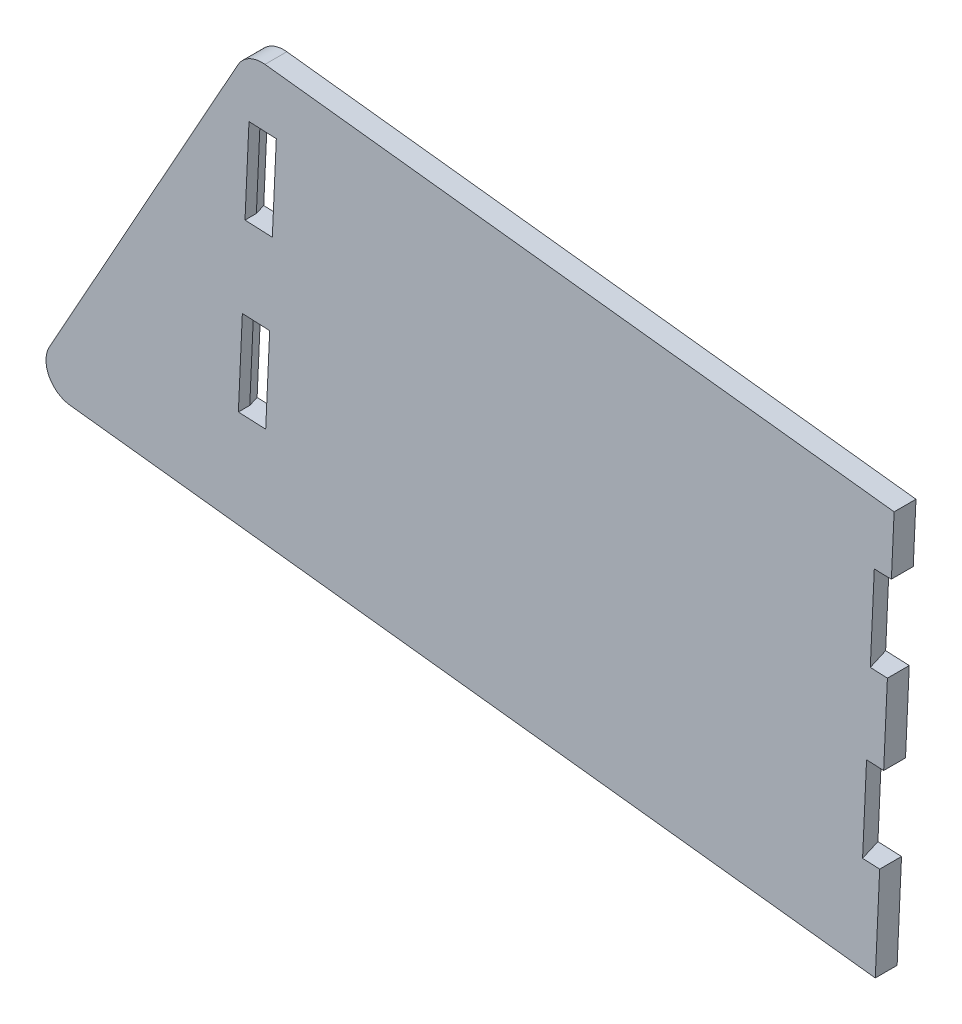
from build123d import *

# Parameters (mm, degrees)
RESSALTO_EXTRUS_O1_DEPTH = 4
RESSALTO_EXTRUS_O5_DEPTH = 4
ESBO_O15_W               = 16
ESBO_O15_H               = 4.2
ESBO_O15_H_2             = 3
CORTE_EXTRUS_O2_DEPTH    = 137.905868833
CORTE_EXTRUS_O3_DEPTH    = 141.792239382
FILETE1_R                = 5
CORTE_EXTRUS_O4_DEPTH    = 141.602820342


with BuildPart() as part:
    # Esboço1 → Ressalto-extrusão1 (new body)
    with BuildSketch(Plane.XY):
        Polygon((0, 0), (0, 76), (118.45022022, 62.267517703), (115, -13.332482297), align=None)
    extrude(amount=RESSALTO_EXTRUS_O1_DEPTH)

    # Esboço13 → Ressalto-extrusão5 (add)
    with BuildSketch(Plane.XY.offset(4)):
        Polygon((0, 0), (-39.756896509, 4.609201034), (0, 76), align=None)
    extrude(amount=-RESSALTO_EXTRUS_O5_DEPTH)

    # Esboço15 → Corte-extrusão2 (cut, through all)
    with BuildSketch(Plane(origin=(10.533319004, -0.48071786, 35.325049871), x_dir=(0.045590380198121984, 0.9989602180434368, 0), z_dir=(0.28572546626048706, -0.013039891282772654, 0.9582227920298917))):
        with Locations((57.047089405, 0.914508914)):
            Rectangle(ESBO_O15_W, ESBO_O15_H)
        with Locations((26.001686631, 0.719596914)):
            Rectangle(ESBO_O15_W, ESBO_O15_H)
        with Locations((48.602963636, -108.019389568)):
            Rectangle(ESBO_O15_W, ESBO_O15_H_2)
        with Locations((17.602963636, -108.019389568)):
            Rectangle(ESBO_O15_W, ESBO_O15_H_2)
    extrude(amount=-CORTE_EXTRUS_O2_DEPTH, mode=Mode.SUBTRACT)

    # Esboço16 → Corte-extrusão3 (cut, through all)
    with BuildSketch(Plane.XY.offset(4)):
        Polygon((116.384955754, 51.350322393), (121.395369813, 51.350322393), (120.655509671, 35.138769736), (115.655509671, 35.366958904), align=None)
        Polygon((114.971653968, 20.382555633), (118.971653968, 20.200004299), (118.242207885, 4.21664081), (114.242207885, 4.399192144), align=None)
    extrude(amount=-CORTE_EXTRUS_O3_DEPTH, mode=Mode.SUBTRACT)

    # Filete1
    filete1_edges = [part.edges().sort_by_distance(p)[0] for p in [
        (-39.756896509, 4.609201034, 2),
        (0, 76, 2),
    ]]
    fillet(filete1_edges, radius=FILETE1_R)

    # Esboço19 → Corte-extrusão4 (cut, through all)
    with BuildSketch(Plane.XY.offset(4)):
        Polygon((5.394142853, 64.868617599), (0.394142853, 65.096806767), (-0.33530323, 49.113443279), (4.66469677, 48.885254111), align=None)
        Polygon((4.181969533, 33.84622174), (3.45252345, 17.862858252), (-1.54747655, 18.091047419), (-0.818030467, 34.074410908), align=None)
    extrude(amount=-CORTE_EXTRUS_O4_DEPTH, mode=Mode.SUBTRACT)


solid = part.part
